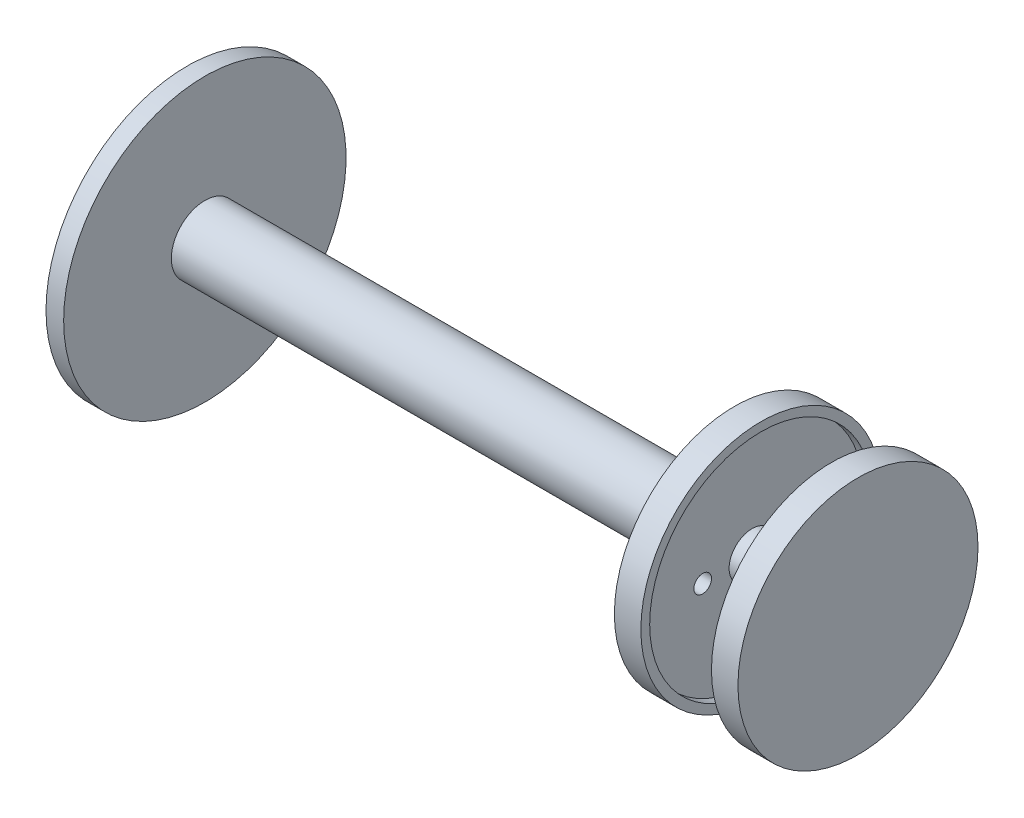
from build123d import *

# Parameters (mm, degrees)
SKETCH2_R           = 19
BOSS_EXTRUDE1_DEPTH = 300
SKETCH3_R           = 5
CUT_EXTRUDE1_DEPTH  = 10
SKETCH4_R           = 80
BOSS_EXTRUDE2_DEPTH = 10


with BuildPart() as part:
    # Sketch1 → Revolve1 (revolve)
    with BuildSketch(Plane.XY, mode=Mode.PRIVATE) as revolve1_sk:
        Polygon((-35.7804045, 0), (34.2195955, 0), (34.2195955, 68), (19.2195955, 68), (19.2195955, 63), (24.2195955, 63), (24.2195955, 13), (-25.7804045, 13), (-25.7804045, 63), (-20.7804045, 63), (-20.7804045, 68), (-35.7804045, 68), align=None)
    revolve(revolve1_sk.sketch.rotate(Axis((-140.082607732, 0, 0), (1, 0, 0)), 90), axis=Axis((-140.082607732, 0, 0), (1, 0, 0)))

    # Sketch2 → Boss-Extrude1 (add)
    with BuildSketch(Plane.ZY.offset(35.7804045)):
        with Locations(Location((0, 0, 0), (0, 0, 180))):
            Circle(SKETCH2_R)
    extrude(amount=BOSS_EXTRUDE1_DEPTH)

    # Sketch3 → Cut-Extrude1 (cut)
    with BuildSketch(Plane.ZY.offset(35.7804045)):
        with Locations((27.961616464, 0)):
            Circle(SKETCH3_R)
    extrude(amount=-CUT_EXTRUDE1_DEPTH, mode=Mode.SUBTRACT)

    # Sketch4 → Boss-Extrude2 (add)
    with BuildSketch(Plane.ZY.offset(335.7804045)):
        Circle(SKETCH4_R)
    extrude(amount=BOSS_EXTRUDE2_DEPTH)


solid = part.part
